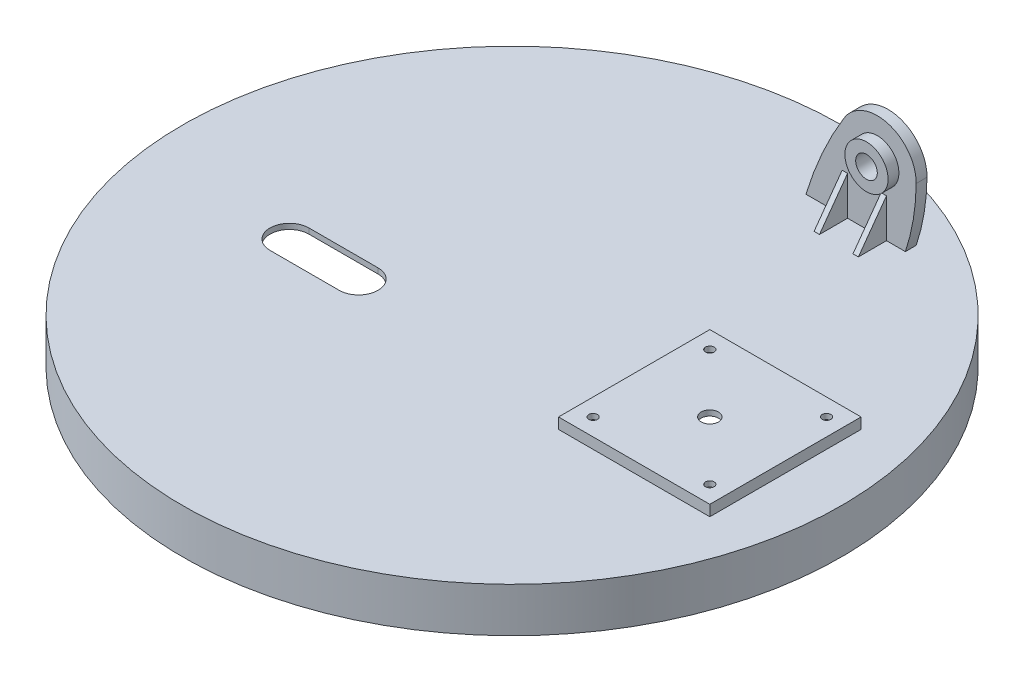
from build123d import *

# Parameters (mm, degrees)
SKETCH_1_R          = 305
EXTRUDE_1_DEPTH     = 41.2
SKETCH_2_W          = 140
SKETCH_2_H          = 140
EXTRUDE_2_DEPTH     = 10
SHELL_1_T           = -5
CUT_EXTRUDE_1_DEPTH = 10
SKETCH_4_W          = 120
SKETCH_4_H          = 10
EXTRUDE_3_DEPTH     = 150
CUT_EXTRUDE_3_DEPTH = 648.322516216
SKETCH_6_R          = 10
CUT_EXTRUDE_5_DEPTH = 634.476787262
EXTRUDE_START       = 10
SKETCH_7_R          = 20
SKETCH_7_R_2        = 10
EXTRUDE_4_DEPTH     = 10
SKETCH_8_W          = 5
SKETCH_8_H          = 36
EXTRUDE_5_DEPTH     = 26
CUT_EXTRUDE_6_DEPTH = 536.715493522
SKETCH_10_W         = 5
SKETCH_10_H         = 46.5
SKETCH_10_W_2       = 19
SKETCH_10_H_2       = 5
SKETCH_11_R         = 8
SKETCH_11_R_2       = 4
CUT_EXTRUDE_7_DEPTH = 440.824965185


with BuildPart() as part:
    # 草图1 → 凸台-拉伸1 (new body)
    with BuildSketch(Plane(origin=(0, 0, 0), x_dir=(1, 0, 0), z_dir=(0, 1, 0))):
        with Locations(Location((0, 0, 0), (0, 0, 90))):
            Circle(SKETCH_1_R)
    extrude(amount=EXTRUDE_1_DEPTH)

    # 草图2 → 凸台-拉伸2 (add)
    with BuildSketch(Plane(origin=(0, 41.2, 0), x_dir=(1, 0, 0), z_dir=(0, 1, 0))):
        with Locations((183, 0)):
            Rectangle(SKETCH_2_W, SKETCH_2_H)
    extrude(amount=EXTRUDE_2_DEPTH)

    # 抽壳1
    shell_1_openings = [part.faces().sort_by_distance(p)[0] for p in [
        (0, 0, 0),
    ]]
    offset(amount=SHELL_1_T, openings=shell_1_openings, kind=Kind.INTERSECTION)

    # 草图3 → 切除-拉伸1 (cut)
    with BuildSketch(Plane(origin=(0, 41.2, 0), x_dir=(1, 0, 0), z_dir=(0, 1, 0))):
        with BuildLine():
            Line((-164, -24), (-100, -24))
            ThreePointArc((-100, -24), (-82, -42), (-100, -60))
            Line((-100, -60), (-164, -60))
            ThreePointArc((-164, -60), (-182, -42), (-164, -24))
        make_face()
    extrude(amount=-CUT_EXTRUDE_1_DEPTH, mode=Mode.SUBTRACT)

    # 草图4 → 凸台-拉伸3 (add)
    with BuildSketch(Plane(origin=(0, 41.2, 0), x_dir=(1, 0, 0), z_dir=(0, 1, 0))):
        with Locations((99, 238)):
            Rectangle(SKETCH_4_W, SKETCH_4_H)
    extrude(amount=EXTRUDE_3_DEPTH)

    # 草图5 → 切除-拉伸3 (cut, through all)
    with BuildSketch(Plane.XY.offset(-233)):
        with BuildLine():
            Line((131, 41.2), (159, 41.2))
            Line((159, 41.2), (159, 191.2))
            Line((159, 191.2), (39, 191.2))
            Line((39, 191.2), (39, 41.2))
            ThreePointArc((39, 41.2), (54.112125435, 81.748594957), (74.310300259, 120.018669715))
            ThreePointArc((74.310300259, 120.018669715), (114.95864882, 135.795163154), (140.99801314, 100.821780537))
            ThreePointArc((140.99801314, 100.821780537), (138.32356193, 70.621084147), (131, 41.2))
        make_face()
    extrude(amount=-CUT_EXTRUDE_3_DEPTH, mode=Mode.SUBTRACT)

    # 草图6 → 切除-拉伸5 (cut, through all)
    with BuildSketch(Plane.XY.offset(-233)):
        with Locations((105, 101.2)):
            Circle(SKETCH_6_R)
    extrude(amount=-CUT_EXTRUDE_5_DEPTH, mode=Mode.SUBTRACT)

    # 草图7 → 凸台-拉伸4 (add)
    with BuildSketch(Plane.XY.offset(-233).offset(EXTRUDE_START)):
        with Locations(Location((105, 101.2, 0), (0, 0, 180))):
            Circle(SKETCH_7_R)
        with Locations((105, 101.2)):
            Circle(SKETCH_7_R_2, mode=Mode.SUBTRACT)
    extrude(amount=-EXTRUDE_4_DEPTH)

    # 草图8 → 凸台-拉伸5 (add)
    with BuildSketch(Plane.XY.offset(-233)):
        with Locations((75, 59.2)):
            Rectangle(SKETCH_8_W, SKETCH_8_H)
        with Locations((111, 59.2)):
            Rectangle(SKETCH_8_W, SKETCH_8_H)
    extrude(amount=EXTRUDE_5_DEPTH)

    # 草图9 → 切除-拉伸6 (cut, through all)
    with BuildSketch(Plane(origin=(113.5, 0, 0), x_dir=(0, 0, -1), z_dir=(1, 0, 0))):
        Polygon((207, 41.2), (233, 77.2), (207, 77.2), align=None)
    extrude(amount=-CUT_EXTRUDE_6_DEPTH, mode=Mode.SUBTRACT)

    # 草图10 → 旋转1 (revolve)
    with BuildSketch(Plane.XY, mode=Mode.PRIVATE) as revolve_1_sk:
        with Locations((-82.5, 12.95)):
            Rectangle(SKETCH_10_W, SKETCH_10_H)
        with Locations((-65.5, 33.7)):
            Rectangle(SKETCH_10_W_2, SKETCH_10_H_2)
    revolve(revolve_1_sk.sketch.rotate(Axis((0, 0, 0), (0, 1, 0)), 270), axis=Axis((0, 0, 0), (0, 1, 0)))

    # 草图11 → 切除-拉伸7 (cut, through all)
    with BuildSketch(Plane(origin=(0, 51.2, 0), x_dir=(1, 0, 0), z_dir=(0, 1, 0))):
        with Locations(Location((183, 0, 0), (0, 0, 270))):
            Circle(SKETCH_11_R)
        with Locations(Location((237, 54, 0), (0, 0, 270))):
            Circle(SKETCH_11_R_2)
        with Locations(Location((129, 54, 0), (0, 0, 270))):
            Circle(SKETCH_11_R_2)
        with Locations(Location((129, -54, 0), (0, 0, 270))):
            Circle(SKETCH_11_R_2)
        with Locations(Location((237, -54, 0), (0, 0, 270))):
            Circle(SKETCH_11_R_2)
    extrude(amount=-CUT_EXTRUDE_7_DEPTH, mode=Mode.SUBTRACT)


solid = part.part
